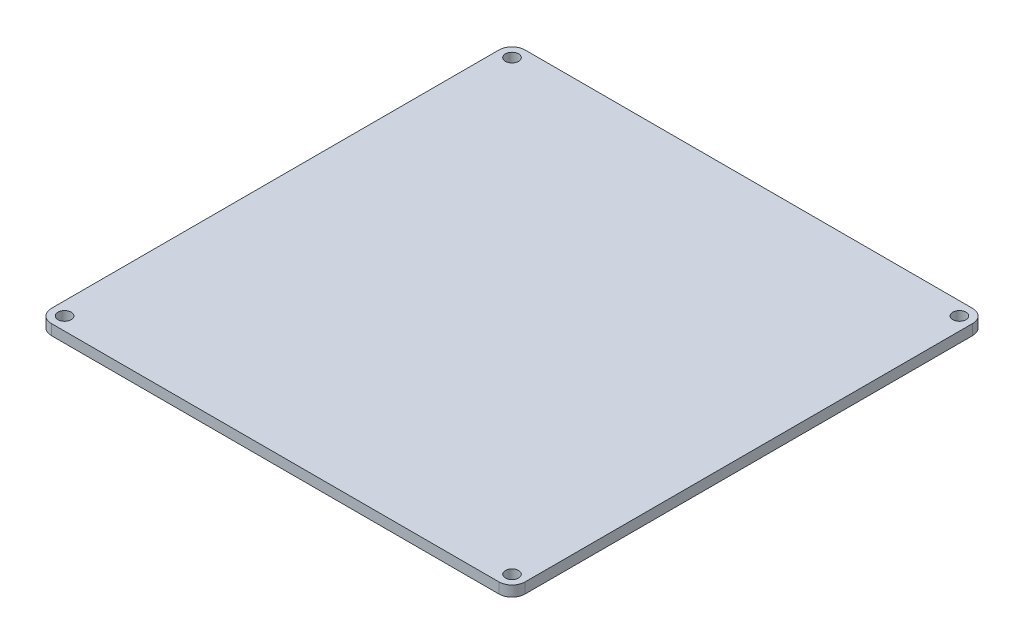
from build123d import *

# Parameters (mm, degrees)
CROQUIS1_W              = 180
CROQUIS1_H              = 180
CROQUIS1_R              = 2.5
SALIENTE_EXTRUIR1_DEPTH = 4
REDONDEO1_R             = 5


with BuildPart() as part:
    # Croquis1 → Saliente-Extruir1 (new body)
    with BuildSketch(Plane(origin=(0, 0, 0), x_dir=(1, 0, 0), z_dir=(0, 1, 0))):
        with Locations((90, 90)):
            Rectangle(CROQUIS1_W, CROQUIS1_H)
        with Locations(Location((5, 175, 0), (0, 0, 270))):
            Circle(CROQUIS1_R, mode=Mode.SUBTRACT)
        with Locations(Location((175, 175, 0), (0, 0, 270))):
            Circle(CROQUIS1_R, mode=Mode.SUBTRACT)
        with Locations(Location((175, 5, 0), (0, 0, 270))):
            Circle(CROQUIS1_R, mode=Mode.SUBTRACT)
        with Locations(Location((5, 5, 0), (0, 0, 270))):
            Circle(CROQUIS1_R, mode=Mode.SUBTRACT)
    extrude(amount=SALIENTE_EXTRUIR1_DEPTH)

    # Redondeo1
    redondeo1_edges = [part.edges().sort_by_distance(p)[0] for p in [
        (0, 2, -180),
        (180, 2, -180),
        (180, 2, 0),
        (0, 2, 0),
    ]]
    fillet(redondeo1_edges, radius=REDONDEO1_R)


solid = part.part
